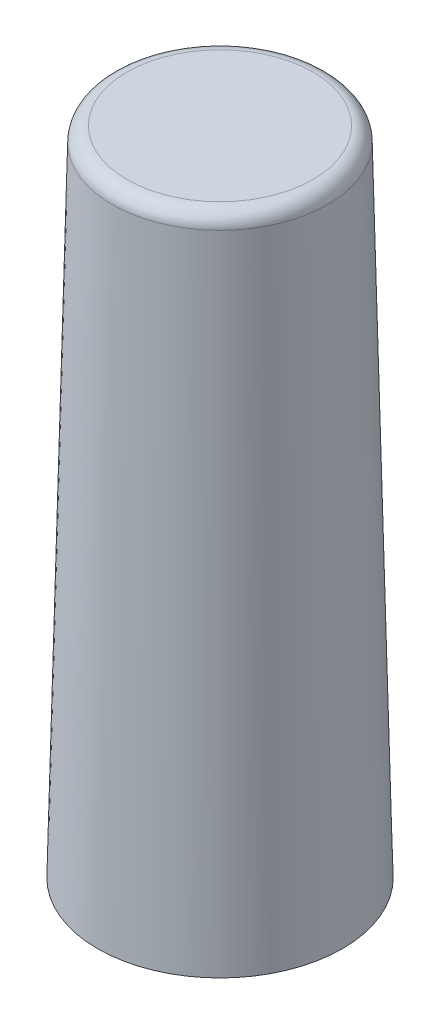
from build123d import *

# Parameters (mm, degrees)
BOSS_EXTRUDE2_REACH = 139.619
SKETCH6_R           = 4
SKETCH7_R           = 2
CUT_EXTRUDE2_DEPTH  = 5
SKETCH8_R           = 19
CUT_EXTRUDE4_DEPTH  = 83


with BuildPart() as part:
    # Sketch1 → Revolve1 (revolve)
    with BuildSketch(Plane(origin=(0, 0, 0), x_dir=(0, 0, -1), z_dir=(1, 0, 0)), mode=Mode.PRIVATE) as revolve1_sk:
        with BuildLine():
            Line((-22, 130), (-25, 0))
            Line((-25, 0), (-16, 0))
            Line((-16, 0), (-16, 5))
            Line((-16, 5), (-22.884082911, 5))
            Line((-22.884082911, 5), (-20.000532332, 129.953858438))
            Line((-20.000532332, 129.953858438), (-19.998935124, 130.023070781))
            ThreePointArc((-19.998935124, 130.023070781), (-19.698103722, 130.715217023), (-18.99920129, 131))
            Line((-18.99920129, 131), (-16.1975525, 131))
            Line((-16.1975525, 131), (0, 131))
            Line((0, 131), (0, 133))
            Line((0, 133), (-16.1975525, 133))
            Line((-16.1975525, 133), (-18.99920129, 133))
            ThreePointArc((-18.99920129, 133), (-21.095908586, 132.14565107), (-21.998402792, 130.069212342))
            Line((-21.998402792, 130.069212342), (-22, 130))
        make_face()
    revolve(revolve1_sk.sketch.rotate(Axis((0, 0, 0), (0, 1, 0)), 180), axis=Axis((0, 0, 0), (0, 1, 0)))

    # Sketch6 → Boss-Extrude2 (add, up to next)
    with BuildSketch(Plane.XZ, mode=Mode.PRIVATE) as boss_extrude2_sk1:
        with Locations((0, 20.5)):
            Circle(SKETCH6_R)
    boss_extrude2_tool1 = extrude(boss_extrude2_sk1.sketch, amount=-BOSS_EXTRUDE2_REACH, mode=Mode.PRIVATE) - part.part
    # Sketch6 → Boss-Extrude2 (add, up to next)
    with BuildSketch(Plane.XZ, mode=Mode.PRIVATE) as boss_extrude2_sk2:
        with Locations((17.753520778, -10.25)):
            Circle(SKETCH6_R)
    boss_extrude2_tool2 = extrude(boss_extrude2_sk2.sketch, amount=-BOSS_EXTRUDE2_REACH, mode=Mode.PRIVATE) - part.part
    # Sketch6 → Boss-Extrude2 (add, up to next)
    with BuildSketch(Plane.XZ, mode=Mode.PRIVATE) as boss_extrude2_sk3:
        with Locations((-17.753520778, -10.25)):
            Circle(SKETCH6_R)
    boss_extrude2_tool3 = extrude(boss_extrude2_sk3.sketch, amount=-BOSS_EXTRUDE2_REACH, mode=Mode.PRIVATE) - part.part
    add(boss_extrude2_tool1.solids().sort_by_distance((0, 0, 20.5))[0])
    add(boss_extrude2_tool2.solids().sort_by_distance((17.753521, 0, -10.25))[0])
    add(boss_extrude2_tool3.solids().sort_by_distance((-17.753521, 0, -10.25))[0])

    # Sketch7 → Cut-Extrude2 (cut)
    with BuildSketch(Plane.XZ):
        with Locations(Location((0, 20.5, 0), (0, 0, 270))):
            Circle(SKETCH7_R)
        with Locations(Location((17.753520778, -10.25, 0), (0, 0, 270))):
            Circle(SKETCH7_R)
        with Locations(Location((-17.753520778, -10.25, 0), (0, 0, 270))):
            Circle(SKETCH7_R)
    extrude(amount=-CUT_EXTRUDE2_DEPTH, mode=Mode.SUBTRACT)

    # Sketch8 → Cut-Extrude4 (cut)
    with BuildSketch(Plane(origin=(0, 48, 0), x_dir=(-1, 0, 0), z_dir=(0, -1, 0))):
        Circle(SKETCH8_R)
    extrude(amount=-CUT_EXTRUDE4_DEPTH, mode=Mode.SUBTRACT)


solid = part.part
